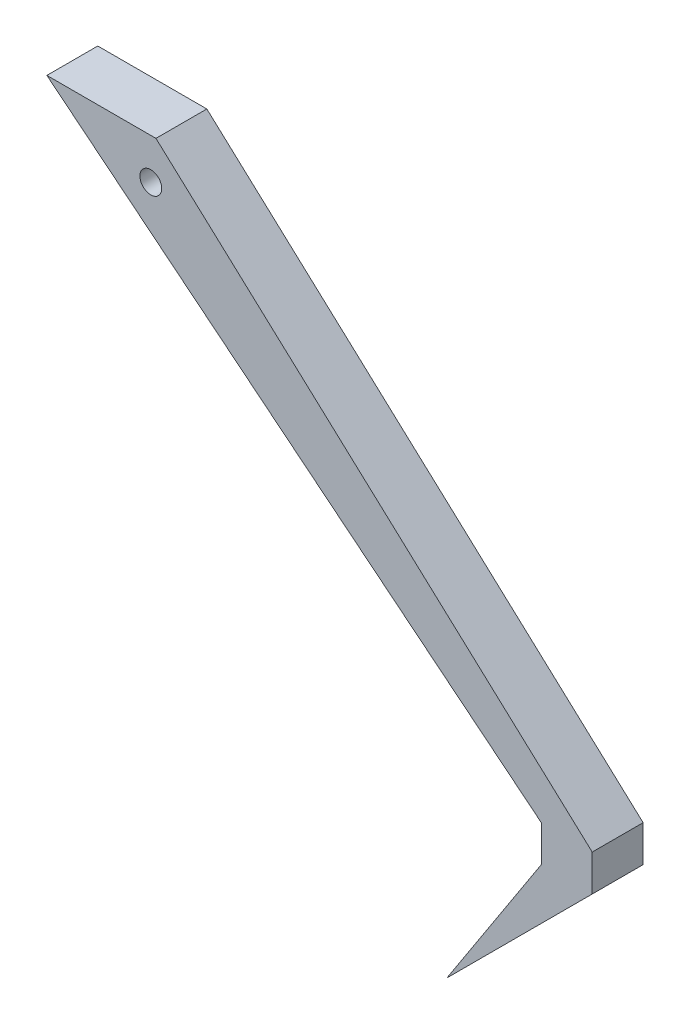
from build123d import *

# Parameters (mm, degrees)
BOSS_EXTRUDE1_DEPTH = 7
SKETCH2_R           = 1.5
CUT_EXTRUDE3_DEPTH  = 7.5


with BuildPart() as part:
    # Sketch1 → Boss-Extrude1 (new body)
    with BuildSketch(Plane.XY):
        Polygon((0, 0), (60, -55), (60, -60), (40, -80), (53, -60), (53, -55), (-15, 0), align=None)
    extrude(amount=BOSS_EXTRUDE1_DEPTH)

    # Sketch2 → Cut-Extrude3 (cut, symmetric)
    with BuildSketch(Plane.XY.offset(7)):
        with Locations((-0.705610521, -5.582063241)):
            Circle(SKETCH2_R)
    extrude(amount=CUT_EXTRUDE3_DEPTH, both=True, mode=Mode.SUBTRACT)


solid = part.part
